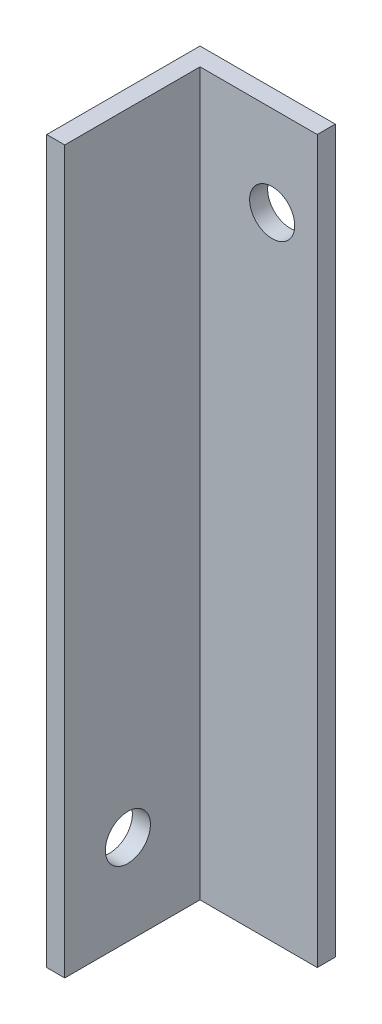
from build123d import *

# Parameters (mm, degrees)
ESQUISSE1_W             = 15
ESQUISSE1_H             = 80
BOSS_EXTRU_1_DEPTH      = 2
ESQUISSE2_W             = 2
ESQUISSE2_H             = 80
BOSS_EXTRU_2_DEPTH      = 15
ESQUISSE3_R             = 2.5
ENL_V_MAT_EXTRU_1_DEPTH = 20
ESQUISSE4_R             = 2.5
ENL_V_MAT_EXTRU_2_DEPTH = 20


with BuildPart() as part:
    # Esquisse1 → Boss.-Extru.1 (new body)
    with BuildSketch(Plane.XY):
        with Locations((7.5, -40)):
            Rectangle(ESQUISSE1_W, ESQUISSE1_H)
    extrude(amount=BOSS_EXTRU_1_DEPTH)

    # Esquisse2 → Boss.-Extru.2 (add)
    with BuildSketch(Plane.XY.offset(2)):
        with Locations((1, -40)):
            Rectangle(ESQUISSE2_W, ESQUISSE2_H)
    extrude(amount=BOSS_EXTRU_2_DEPTH)

    # Esquisse3 → Enlèv. mat.-Extru.1 (cut)
    with BuildSketch(Plane.XY.offset(2)):
        with Locations((10, -10)):
            Circle(ESQUISSE3_R)
    extrude(amount=-ENL_V_MAT_EXTRU_1_DEPTH, mode=Mode.SUBTRACT)

    # Esquisse4 → Enlèv. mat.-Extru.2 (cut)
    with BuildSketch(Plane.ZY):
        with Locations(Location((10, -70, 0), (0, 0, 270))):
            Circle(ESQUISSE4_R)
    extrude(amount=-ENL_V_MAT_EXTRU_2_DEPTH, mode=Mode.SUBTRACT)


solid = part.part
